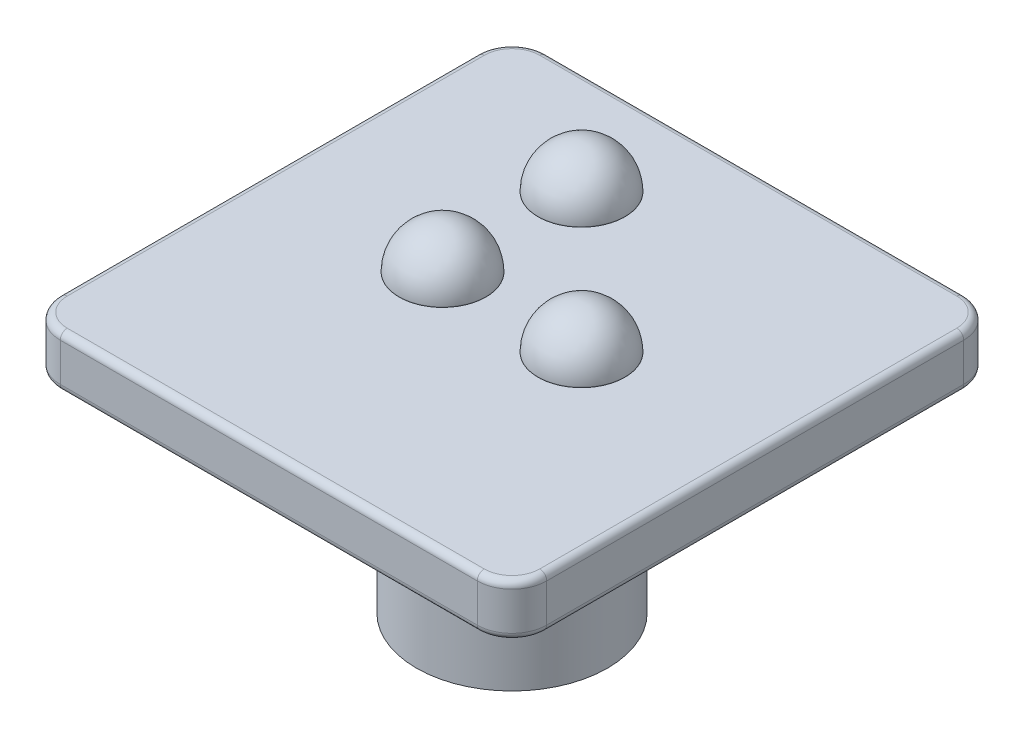
from build123d import *

# Parameters (mm, degrees)
BOSS_EXTRUDE1_DEPTH = 1.5
SKETCH2_R           = 2.75
BOSS_EXTRUDE2_DEPTH = 6
SKETCH3_W           = 1.1
SKETCH3_H           = 1.45
SKETCH3_W_2         = 1.45
SKETCH3_H_2         = 1.1
CUT_EXTRUDE1_DEPTH  = 6
CHAMFER1_SIZE       = 0.3
FILLET1_R           = 1
SKETCH4_R           = 1.25
BOSS_EXTRUDE3_DEPTH = 0.01
DOME1_FACE_RADIUS   = 1.25
DOME1_HEIGHT        = 1.25
DOME3_FACE_RADIUS   = 1.25
DOME3_HEIGHT        = 1.25
DOME4_FACE_RADIUS   = 1.25
DOME4_HEIGHT        = 1.25
FILLET3_R           = 0.2


with BuildPart() as part:
    # Sketch1 → Boss-Extrude1 (new body)
    with BuildSketch(Plane(origin=(0, 0, 0), x_dir=(1, 0, 0), z_dir=(0, 1, 0))):
        with BuildLine():
            Line((-7.324675649, 4.396717546), (4.675324351, 4.396717546))
            ThreePointArc((4.675324351, 4.396717546), (5.382431132, 4.103824327), (5.675324351, 3.396717546))
            Line((5.675324351, 3.396717546), (5.675324351, -8.603282454))
            ThreePointArc((5.675324351, -8.603282454), (5.382431132, -9.310389235), (4.675324351, -9.603282454))
            Line((4.675324351, -9.603282454), (-7.324675649, -9.603282454))
            ThreePointArc((-7.324675649, -9.603282454), (-8.03178243, -9.310389235), (-8.324675649, -8.603282454))
            Line((-8.324675649, -8.603282454), (-8.324675649, 3.396717546))
            ThreePointArc((-8.324675649, 3.396717546), (-8.03178243, 4.103824327), (-7.324675649, 4.396717546))
        make_face()
    extrude(amount=BOSS_EXTRUDE1_DEPTH)

    # Sketch2 → Boss-Extrude2 (add)
    with BuildSketch(Plane.XZ):
        with Locations(Location((-1.324675649, 2.603282454, 0), (0, 0, 270))):
            Circle(SKETCH2_R)
    extrude(amount=BOSS_EXTRUDE2_DEPTH)

    # Sketch3 → Cut-Extrude1 (cut)
    with BuildSketch(Plane.XZ.offset(6)):
        with Locations((-1.324675649, 3.878282454)):
            Rectangle(SKETCH3_W, SKETCH3_H)
        with Locations((-0.049675649, 2.603282454)):
            Rectangle(SKETCH3_W_2, SKETCH3_H_2)
        with Locations((-1.324675649, 2.603282454)):
            Rectangle(SKETCH3_W, SKETCH3_H_2)
        with Locations((-2.599675649, 2.603282454)):
            Rectangle(SKETCH3_W_2, SKETCH3_H_2)
        with Locations((-1.324675649, 1.328282454)):
            Rectangle(SKETCH3_W, SKETCH3_H)
    extrude(amount=-CUT_EXTRUDE1_DEPTH, mode=Mode.SUBTRACT)

    # Chamfer1
    chamfer1_edges = [part.edges().sort_by_distance(p)[0] for p in [
        (-0.774675649, -6, 3.878282454),
        (-0.049675649, -6, 3.153282454),
        (0.675324351, -6, 2.603282454),
        (-0.774675649, -6, 1.328282454),
        (-2.599675649, -6, 3.153282454),
        (-1.324675649, -6, 4.603282454),
        (-1.874675649, -6, 3.878282454),
        (-3.324675649, -6, 2.603282454),
        (-2.599675649, -6, 2.053282454),
        (-1.874675649, -6, 1.328282454),
        (-1.324675649, -6, 0.603282454),
        (-0.049675649, -6, 2.053282454),
    ]]
    chamfer(chamfer1_edges, length=CHAMFER1_SIZE)

    # Fillet1
    fillet1_edges = [part.edges().sort_by_distance(p)[0] for p in [
        (-1.324675649, 0, 5.353282454),
    ]]
    fillet(fillet1_edges, radius=FILLET1_R)

    # Sketch4 → Boss-Extrude3 (add)
    with BuildSketch(Plane(origin=(0, 1.5, 0), x_dir=(1, 0, 0), z_dir=(0, 1, 0))):
        with Locations(Location((-3.324675649, 1.396717546, 0), (0, 0, 90))):
            Circle(SKETCH4_R)
        with Locations(Location((0.675324351, -2.603282454, 0), (0, 0, 90))):
            Circle(SKETCH4_R)
        with Locations(Location((-3.324675649, -2.603282454, 0), (0, 0, 90))):
            Circle(SKETCH4_R)
    extrude(amount=BOSS_EXTRUDE3_DEPTH)

    # Dome1: a dome of height H over a round flat face of radius A is a cap of a sphere of radius (A * A + H * H) / (2 * H)
    dome1_r = (DOME1_FACE_RADIUS * DOME1_FACE_RADIUS + DOME1_HEIGHT * DOME1_HEIGHT) / (2 * DOME1_HEIGHT)
    dome1_base = Plane((-3.324675649, 1.51, -1.396717546), z_dir=(0, 1, 0))
    with Locations(dome1_base.offset(DOME1_HEIGHT - dome1_r)):
        dome1_ball = Sphere(dome1_r, mode=Mode.PRIVATE)
    add(split(dome1_ball, bisect_by=dome1_base, keep=Keep.TOP, mode=Mode.PRIVATE))

    # Dome3: a dome of height H over a round flat face of radius A is a cap of a sphere of radius (A * A + H * H) / (2 * H)
    dome3_r = (DOME3_FACE_RADIUS * DOME3_FACE_RADIUS + DOME3_HEIGHT * DOME3_HEIGHT) / (2 * DOME3_HEIGHT)
    dome3_base = Plane((-3.324675649, 1.51, 2.603282454), z_dir=(0, 1, 0))
    with Locations(dome3_base.offset(DOME3_HEIGHT - dome3_r)):
        dome3_ball = Sphere(dome3_r, mode=Mode.PRIVATE)
    add(split(dome3_ball, bisect_by=dome3_base, keep=Keep.TOP, mode=Mode.PRIVATE))

    # Dome4: a dome of height H over a round flat face of radius A is a cap of a sphere of radius (A * A + H * H) / (2 * H)
    dome4_r = (DOME4_FACE_RADIUS * DOME4_FACE_RADIUS + DOME4_HEIGHT * DOME4_HEIGHT) / (2 * DOME4_HEIGHT)
    dome4_base = Plane((0.675324351, 1.51, 2.603282454), z_dir=(0, 1, 0))
    with Locations(dome4_base.offset(DOME4_HEIGHT - dome4_r)):
        dome4_ball = Sphere(dome4_r, mode=Mode.PRIVATE)
    add(split(dome4_ball, bisect_by=dome4_base, keep=Keep.TOP, mode=Mode.PRIVATE))

    # Fillet3
    fillet3_edges = [part.edges().sort_by_distance(p)[0] for p in [
        (5.382431132, 1.5, 9.310389235),
        (-1.324675649, 0, 9.603282454),
        (-8.03178243, 0, 9.310389235),
        (5.675324351, 1.5, 2.603282454),
        (5.382431132, 1.5, -4.103824327),
        (-1.324675649, 1.5, -4.396717546),
        (-8.03178243, 1.5, -4.103824327),
        (-8.324675649, 1.5, 2.603282454),
        (-8.03178243, 1.5, 9.310389235),
        (-1.324675649, 1.5, 9.603282454),
        (-8.324675649, 0, 2.603282454),
        (-8.03178243, 0, -4.103824327),
        (-1.324675649, 0, -4.396717546),
        (5.382431132, 0, -4.103824327),
        (5.675324351, 0, 2.603282454),
        (5.382431132, 0, 9.310389235),
    ]]
    fillet(fillet3_edges, radius=FILLET3_R)


solid = part.part
